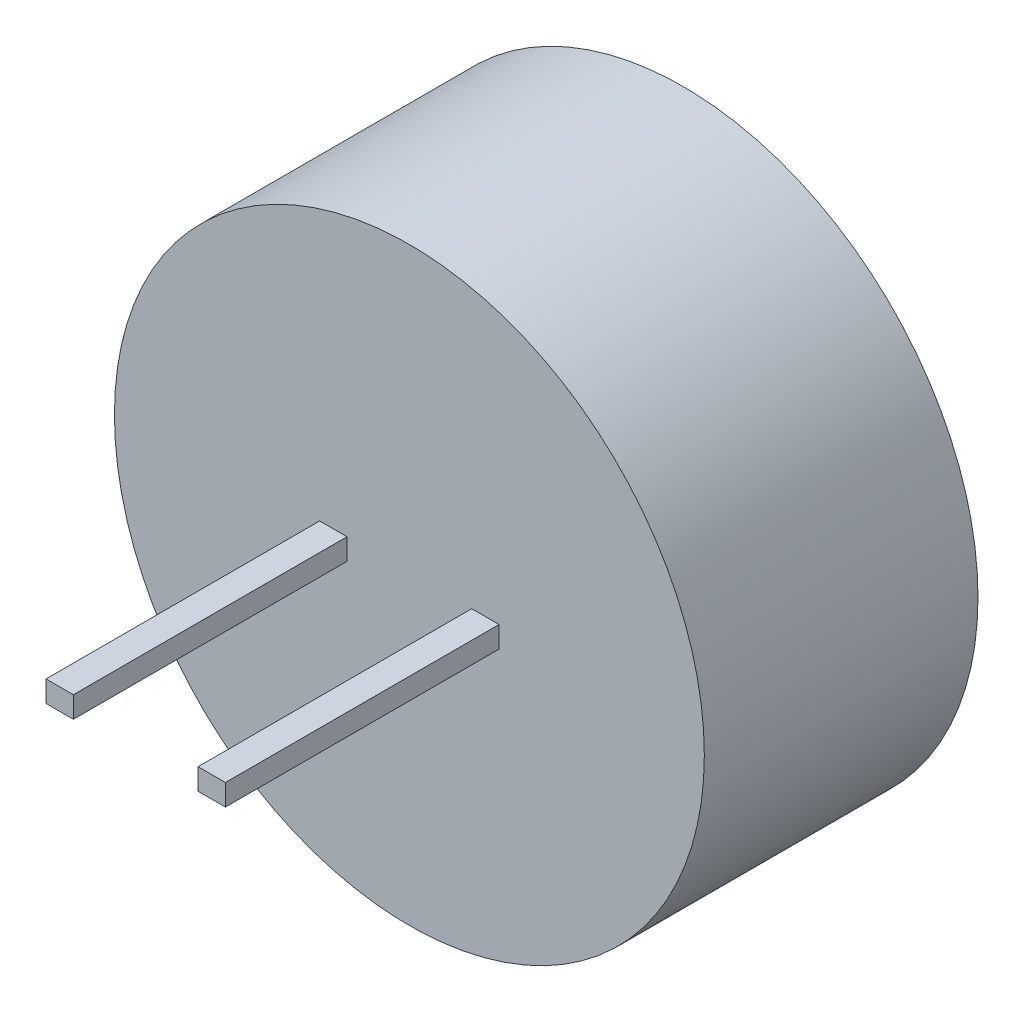
from build123d import *

# Parameters (mm, degrees)
SKETCH2_R           = 4.85
BOSS_EXTRUDE1_DEPTH = 4.5
SKETCH3_W           = 0.45
SKETCH3_H           = 0.35
BOSS_EXTRUDE2_DEPTH = 4.5


with BuildPart() as part:
    # Sketch2 → Boss-Extrude1 (new body)
    with BuildSketch(Plane.XY):
        Circle(SKETCH2_R)
    extrude(amount=BOSS_EXTRUDE1_DEPTH)

    # Sketch3 → Boss-Extrude2 (add)
    with BuildSketch(Plane.XY.offset(4.5)):
        with Locations((-1.25, 0)):
            Rectangle(SKETCH3_W, SKETCH3_H)
        with Locations((1.25, 0)):
            Rectangle(SKETCH3_W, SKETCH3_H)
    extrude(amount=BOSS_EXTRUDE2_DEPTH)


solid = part.part
